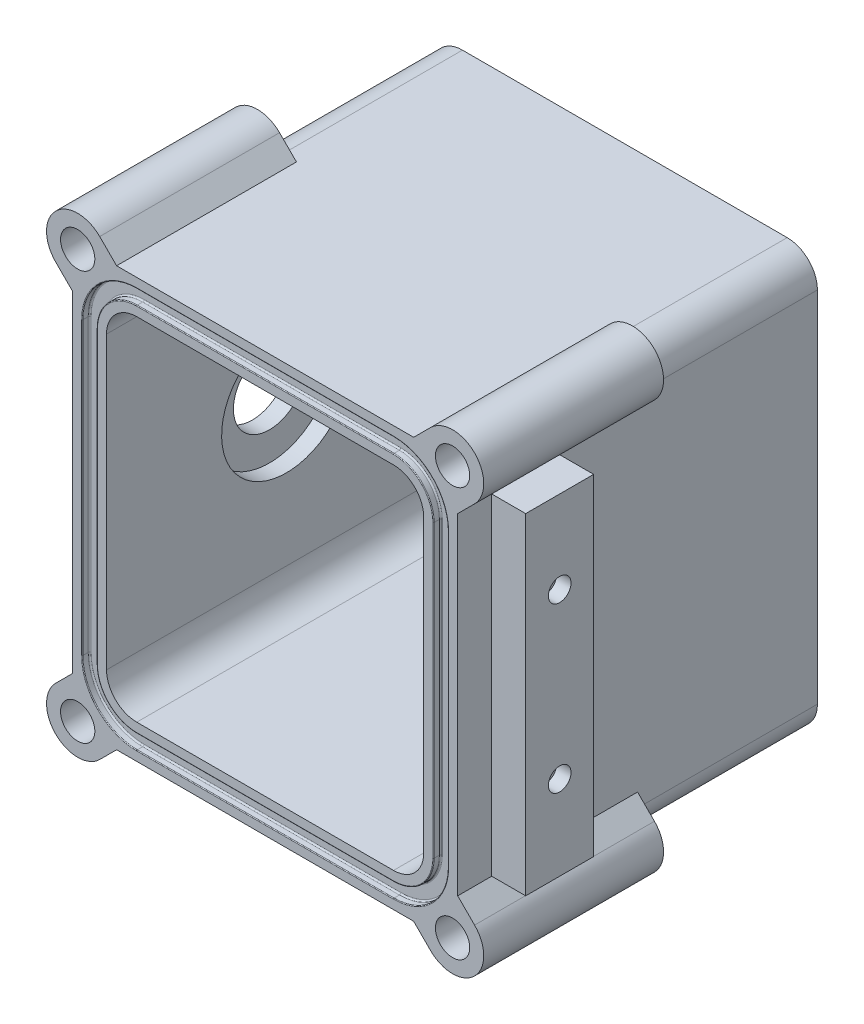
from build123d import *

# Parameters (mm, degrees)
BOSS_EXTRUDE1_DEPTH     = 31.75
SHELL1_T                = -6
FILLET1_R               = 5.334
CUT_EXTRUDE1_DEPTH      = 1.2954
FILLET2_R               = 0.254
FILLET3_R               = 0.127
BOSS_EXTRUDE2_DEPTH     = 31.75
SKETCH4_R               = 3.025
CUT_EXTRUDE2_DEPTH      = 9
MIRROR2_COPY_1_DEPTH    = 31.75
MIRROR2_COPY_2_SKETCH_R = 3.025
MIRROR2_COPY_2_DEPTH    = 9
SKETCH8_W               = 12
SKETCH8_H               = 58.443650814
BOSS_EXTRUDE3_DEPTH     = 6
SKETCH12_R              = 2
CUT_EXTRUDE6_DEPTH      = 2.54
SKETCH13_R              = 6.35
CUT_EXTRUDE10_DEPTH     = 6
SKETCH16_R              = 11.43
CUT_EXTRUDE14_DEPTH     = 3


with BuildPart() as part:
    # Sketch1 → Boss-Extrude1 (new, symmetric)
    with BuildSketch(Plane.XY):
        Polygon((-34, -37), (-34, -16.68), (-34, 16.68), (-34, 37), (34, 37), (34, -37), align=None)
    extrude(amount=BOSS_EXTRUDE1_DEPTH, both=True)

    # Shell1
    shell1_openings = [part.faces().sort_by_distance(p)[0] for p in [
        (0, 0, 31.75),
    ]]
    offset(amount=SHELL1_T, openings=shell1_openings, kind=Kind.INTERSECTION)

    # Fillet1
    fillet1_edges = [part.edges().sort_by_distance(p)[0] for p in [
        (-34, -37, 0),
        (-34, 37, 0),
        (34, 37, 0),
        (34, -37, 0),
        (-28, -31, 3),
        (28, -31, 3),
        (28, 31, 3),
        (-28, 31, 3),
    ]]
    fillet(fillet1_edges, radius=FILLET1_R)

    # Sketch2 → Cut-Extrude1 (cut)
    with BuildSketch(Plane.XY.offset(31.75)):
        with BuildLine():
            Line((32.2827, -25.666), (32.2827, 25.666))
            ThreePointArc((32.2827, 25.666), (29.466033783, 32.466033783), (22.666, 35.2827))
            Line((22.666, 35.2827), (-22.666, 35.2827))
            ThreePointArc((-22.666, 35.2827), (-29.466033783, 32.466033783), (-32.2827, 25.666))
            Line((-32.2827, 25.666), (-32.2827, -25.666))
            ThreePointArc((-32.2827, -25.666), (-29.466033783, -32.466033783), (-22.666, -35.2827))
            Line((-22.666, -35.2827), (22.666, -35.2827))
            ThreePointArc((22.666, -35.2827), (29.466033783, -32.466033783), (32.2827, -25.666))
        make_face()
        with BuildLine():
            Line((-29.7173, 25.666), (-29.7173, -25.666))
            ThreePointArc((-29.7173, -25.666), (-27.652022046, -30.652022046), (-22.666, -32.7173))
            Line((-22.666, -32.7173), (22.666, -32.7173))
            ThreePointArc((22.666, -32.7173), (27.652022046, -30.652022046), (29.7173, -25.666))
            Line((29.7173, -25.666), (29.7173, 25.666))
            ThreePointArc((29.7173, 25.666), (27.652022046, 30.652022046), (22.666, 32.7173))
            Line((22.666, 32.7173), (-22.666, 32.7173))
            ThreePointArc((-22.666, 32.7173), (-27.652022046, 30.652022046), (-29.7173, 25.666))
        make_face(mode=Mode.SUBTRACT)
    extrude(amount=-CUT_EXTRUDE1_DEPTH, mode=Mode.SUBTRACT)

    # Fillet2
    fillet2_edges = [part.edges().sort_by_distance(p)[0] for p in [
        (29.466033783, -32.466033783, 30.4546),
        (0, -35.2827, 30.4546),
        (-29.466033783, -32.466033783, 30.4546),
        (-32.2827, 0, 30.4546),
        (-29.466033783, 32.466033783, 30.4546),
        (0, 35.2827, 30.4546),
        (29.466033783, 32.466033783, 30.4546),
        (32.2827, 0, 30.4546),
        (0, 32.7173, 30.4546),
        (-27.652022046, 30.652022046, 30.4546),
        (-29.7173, 0, 30.4546),
        (-27.652022046, -30.652022046, 30.4546),
        (0, -32.7173, 30.4546),
        (27.652022046, -30.652022046, 30.4546),
        (29.7173, 0, 30.4546),
        (27.652022046, 30.652022046, 30.4546),
    ]]
    fillet(fillet2_edges, radius=FILLET2_R)

    # Fillet3
    fillet3_edges = [part.edges().sort_by_distance(p)[0] for p in [
        (29.466033783, -32.466033783, 31.75),
        (32.2827, 0, 31.75),
        (29.466033783, 32.466033783, 31.75),
        (0, 35.2827, 31.75),
        (-29.466033783, 32.466033783, 31.75),
        (-32.2827, 0, 31.75),
        (-29.466033783, -32.466033783, 31.75),
        (0, -35.2827, 31.75),
        (-27.652022046, 30.652022046, 31.75),
        (0, 32.7173, 31.75),
        (27.652022046, 30.652022046, 31.75),
        (29.7173, 0, 31.75),
        (27.652022046, -30.652022046, 31.75),
        (0, -32.7173, 31.75),
        (-27.652022046, -30.652022046, 31.75),
        (-29.7173, 0, 31.75),
    ]]
    fillet(fillet3_edges, radius=FILLET3_R)

    # Sketch3 → Boss-Extrude2 (add)
    with BuildSketch(Plane.XY.offset(31.75)):
        with BuildLine():
            Line((34, -29.221825407), (34, -31.666))
            ThreePointArc((34, -31.666), (32.437707571, -35.437707571), (28.666, -37))
            Line((28.666, -37), (26.221825407, -37))
            Line((26.221825407, -37), (29.202282953, -39.980457546))
            ThreePointArc((29.202282953, -39.980457546), (36.980457546, -39.980457546), (36.980457546, -32.202282953))
            Line((36.980457546, -32.202282953), (34, -29.221825407))
        make_face()
    boss_extrude2 = extrude(amount=-BOSS_EXTRUDE2_DEPTH)

    # Sketch4 → Cut-Extrude2 (cut)
    with BuildSketch(Plane.XY.offset(31.75)):
        with Locations((33.09137025, -36.09137025)):
            Circle(SKETCH4_R)
    cut_extrude2 = extrude(amount=-CUT_EXTRUDE2_DEPTH, mode=Mode.SUBTRACT)

    # Mirror1: Boss-Extrude2, Cut-Extrude2 across plane
    add(boss_extrude2.mirror(Plane.ZX))
    add(cut_extrude2.mirror(Plane.ZX), mode=Mode.SUBTRACT)

    # Mirror2: Boss-Extrude2, Cut-Extrude2 across plane
    add(boss_extrude2.mirror(Plane(origin=(0, 0, 0), x_dir=(0, 0, 1), z_dir=(1, 0, 0))))
    add(cut_extrude2.mirror(Plane(origin=(0, 0, 0), x_dir=(0, 0, 1), z_dir=(1, 0, 0))), mode=Mode.SUBTRACT)

    # Mirror2 copy 1 sketch → Mirror2 copy 1 (add)
    with BuildSketch(Plane(origin=(0, 0, 31.75), x_dir=(-1, 0, 0), z_dir=(0, 0, 1))):
        with BuildLine():
            Line((34, -29.221825407), (34, -31.666))
            ThreePointArc((34, -31.666), (32.437707571, -35.437707571), (28.666, -37))
            Line((28.666, -37), (26.221825407, -37))
            Line((26.221825407, -37), (29.202282953, -39.980457546))
            ThreePointArc((29.202282953, -39.980457546), (36.980457546, -39.980457546), (36.980457546, -32.202282953))
            Line((36.980457546, -32.202282953), (34, -29.221825407))
        make_face()
    extrude(amount=-MIRROR2_COPY_1_DEPTH)

    # Mirror2 copy 2 sketch → Mirror2 copy 2 (cut)
    with BuildSketch(Plane(origin=(0, 0, 31.75), x_dir=(-1, 0, 0), z_dir=(0, 0, 1))):
        with Locations((33.09137025, -36.09137025)):
            Circle(MIRROR2_COPY_2_SKETCH_R)
    extrude(amount=-MIRROR2_COPY_2_DEPTH, mode=Mode.SUBTRACT)

    # Sketch8 → Boss-Extrude3 (add)
    with BuildSketch(Plane.ZY.offset(34)):
        with Locations((19.75, 0)):
            Rectangle(SKETCH8_W, SKETCH8_H)
    boss_extrude3 = extrude(amount=BOSS_EXTRUDE3_DEPTH)

    # Sketch12 → Cut-Extrude6 (cut)
    with BuildSketch(Plane.ZY.offset(40)):
        with Locations(Location((19.75, 14.616825407, 0), (0, 0, 270))):
            Circle(SKETCH12_R)
        with Locations(Location((19.75, -14.339174593, 0), (0, 0, 270))):
            Circle(SKETCH12_R)
    cut_extrude6 = extrude(amount=-CUT_EXTRUDE6_DEPTH, mode=Mode.SUBTRACT)

    # Sketch13 → Cut-Extrude10 (cut)
    with BuildSketch(Plane.ZY.offset(34)):
        with Locations(Location((0, 0, 0), (0, 0, 270))):
            Circle(SKETCH13_R)
    extrude(amount=-CUT_EXTRUDE10_DEPTH, mode=Mode.SUBTRACT)

    # Sketch16 → Cut-Extrude14 (cut)
    with BuildSketch(Plane(origin=(-28, 0, 0), x_dir=(0, 0, -1), z_dir=(1, 0, 0))):
        with Locations(Location((0, 0, 0), (0, 0, 90))):
            Circle(SKETCH16_R)
    extrude(amount=-CUT_EXTRUDE14_DEPTH, mode=Mode.SUBTRACT)

    # Mirror5: Boss-Extrude3 across plane
    add(boss_extrude3.mirror(Plane(origin=(0, 0, 0), x_dir=(0, 0, 1), z_dir=(1, 0, 0))))

    # Mirror6: Cut-Extrude6 across plane
    add(cut_extrude6.mirror(Plane(origin=(0, 0, 0), x_dir=(0, 0, 1), z_dir=(1, 0, 0))), mode=Mode.SUBTRACT)


solid = part.part
